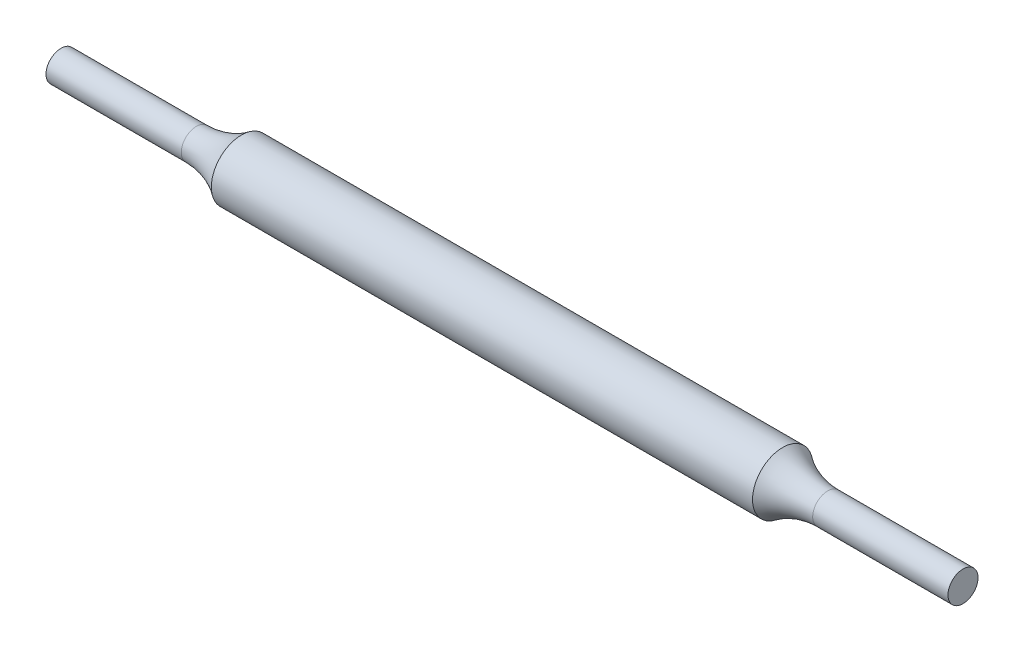
from build123d import *


with BuildPart() as part:
    # Sketch1 → Revolve1 (revolve)
    with BuildSketch(Plane(origin=(0, 0, 0), x_dir=(1, 0, 0), z_dir=(0, 1, 0)), mode=Mode.PRIVATE) as revolve1_sk:
        with BuildLine():
            Line((0, 0), (60, 0))
            Line((60, 0), (60, 1))
            Line((60, 1), (51, 1))
            ThreePointArc((51, 1), (49.41886117, 1.25658351), (48, 2))
            Line((48, 2), (12, 2))
            ThreePointArc((12, 2), (10.58113883, 1.25658351), (9, 1))
            Line((9, 1), (0, 1))
            Line((0, 1), (0, 0))
        make_face()
    revolve(revolve1_sk.sketch.rotate(Axis((0, 0, 0), (1, 0, 0)), 180), axis=Axis((0, 0, 0), (1, 0, 0)))


solid = part.part
